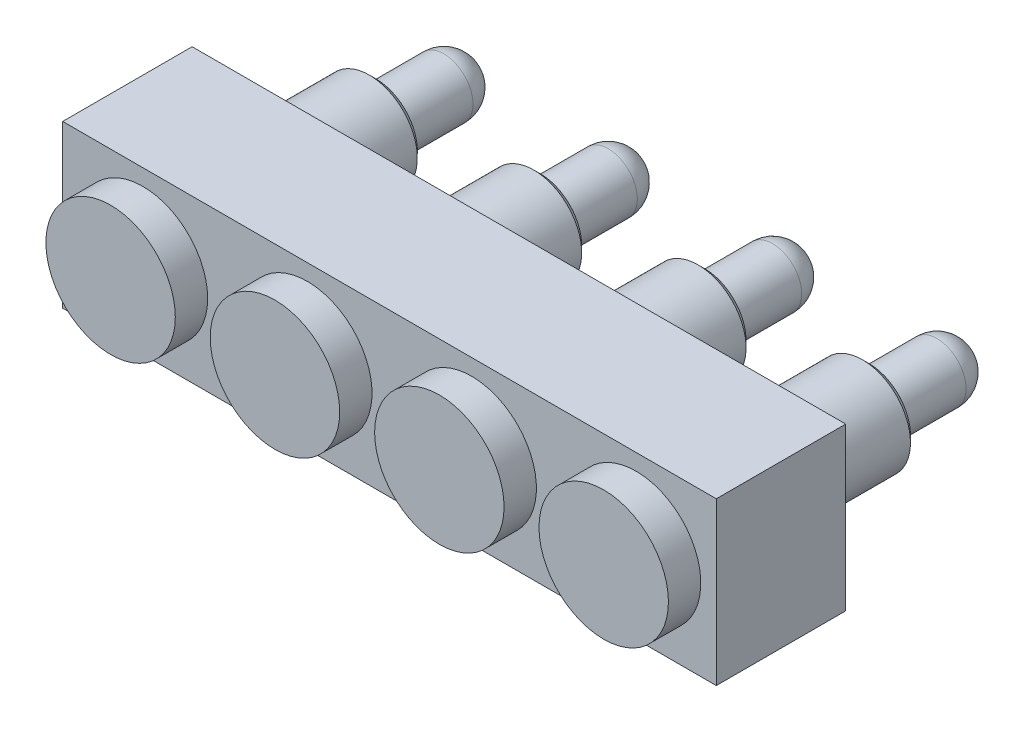
from build123d import *

# Parameters (mm, degrees)
SKETCH_1_W        = 10.1
SKETCH_1_H        = 2.5
SKETCH_1_R        = 0.74
EXTRUDE_1_DEPTH   = 2
SKETCH_2_R        = 1
EXTRUDE_2_DEPTH   = 0.5
SKETCH_3_R        = 0.74
EXTRUDE_3_DEPTH   = 1.6
EXTRUDE_3_2_DEPTH = 1.6
EXTRUDE_3_3_DEPTH = 1.6
EXTRUDE_3_4_DEPTH = 1.6
SKETCH_4_R        = 0.45
EXTRUDE_4_DEPTH   = 3.1
FILLET_1_R        = 0.45
FILLET_2_R        = 0.45
FILLET_3_R        = 0.45
FILLET_4_R        = 0.45
CHAMFER_1_SIZE    = 0.1
CHAMFER_2_SIZE    = 0.1
CHAMFER_3_SIZE    = 0.1
CHAMFER_4_SIZE    = 0.1


with BuildPart() as part:
    # 草图1 → 凸台-拉伸1 (new body)
    with BuildSketch(Plane.XY):
        with Locations((5.05405893, 1.252481567)):
            Rectangle(SKETCH_1_W, SKETCH_1_H)
        with Locations((3.78405893, 1.252481567)):
            Circle(SKETCH_1_R, mode=Mode.SUBTRACT)
        with Locations((1.24405893, 1.252481567)):
            Circle(SKETCH_1_R, mode=Mode.SUBTRACT)
        with Locations(Location((8.86405893, 1.252481567, 0), (0, 0, 180))):
            Circle(SKETCH_1_R, mode=Mode.SUBTRACT)
        with Locations(Location((6.32405893, 1.252481567, 0), (0, 0, 180))):
            Circle(SKETCH_1_R, mode=Mode.SUBTRACT)
    extrude(amount=EXTRUDE_1_DEPTH)

    # 草图2 → 凸台-拉伸2 (add)
    with BuildSketch(Plane.XY.offset(2)):
        with Locations((1.24405893, 1.252481567)):
            Circle(SKETCH_2_R)
        with Locations(Location((3.78405893, 1.252481567, 0), (0, 0, 180))):
            Circle(SKETCH_2_R)
        with Locations(Location((6.32405893, 1.252481567, 0), (0, 0, 180))):
            Circle(SKETCH_2_R)
        with Locations(Location((8.86405893, 1.252481567, 0), (0, 0, 180))):
            Circle(SKETCH_2_R)
    extrude(amount=EXTRUDE_2_DEPTH)


with BuildPart() as body_2:
    # 草图3 → 凸台-拉伸3 (new body)
    with BuildSketch(Plane(origin=(0, 0, 0), x_dir=(-1, 0, 0), z_dir=(0, 0, -1))):
        with Locations((-1.24405893, 1.252481567)):
            Circle(SKETCH_3_R)
    extrude(amount=EXTRUDE_3_DEPTH)



with BuildPart() as body_3:
    # 草图3 → Extrude 3 2 (new body)
    with BuildSketch(Plane(origin=(0, 0, 0), x_dir=(-1, 0, 0), z_dir=(0, 0, -1))):
        with Locations((-3.78405893, 1.252481567)):
            Circle(SKETCH_3_R)
    extrude(amount=EXTRUDE_3_2_DEPTH)


with BuildPart() as body_4:
    # 草图3 → Extrude 3 3 (new body)
    with BuildSketch(Plane(origin=(0, 0, 0), x_dir=(-1, 0, 0), z_dir=(0, 0, -1))):
        with Locations((-6.32405893, 1.252481567)):
            Circle(SKETCH_3_R)
    extrude(amount=EXTRUDE_3_3_DEPTH)


with BuildPart() as body_5:
    # 草图3 → Extrude 3 4 (new body)
    with BuildSketch(Plane(origin=(0, 0, 0), x_dir=(-1, 0, 0), z_dir=(0, 0, -1))):
        with Locations((-8.86405893, 1.252481567)):
            Circle(SKETCH_3_R)
    extrude(amount=EXTRUDE_3_4_DEPTH)


with BuildPart() as body_2_1:
    add(body_2.part)

    add(body_3.part)  # 凸台-拉伸4 merges body 3

    add(body_4.part)  # 凸台-拉伸4 merges body 4

    add(body_5.part)  # 凸台-拉伸4 merges body 5
    # 草图4 → 凸台-拉伸4 (add)
    with BuildSketch(Plane(origin=(0, 0, 0), x_dir=(-1, 0, 0), z_dir=(0, 0, -1))):
        with Locations((-8.86405893, 1.252481567)):
            Circle(SKETCH_4_R)
        with Locations((-6.32405893, 1.252481567)):
            Circle(SKETCH_4_R)
        with Locations((-3.78405893, 1.252481567)):
            Circle(SKETCH_4_R)
        with Locations((-1.24405893, 1.252481567)):
            Circle(SKETCH_4_R)
    extrude(amount=EXTRUDE_4_DEPTH)

    # 圆角1
    fillet_1_edges = [body_2_1.edges().sort_by_distance(p)[0] for p in [
        (9.31405893, 1.252481567, -3.1),
    ]]
    fillet(fillet_1_edges, radius=FILLET_1_R)

    # 圆角2
    fillet_2_edges = [body_2_1.edges().sort_by_distance(p)[0] for p in [
        (6.77405893, 1.252481567, -3.1),
    ]]
    fillet(fillet_2_edges, radius=FILLET_2_R)

    # 圆角3
    fillet_3_edges = [body_2_1.edges().sort_by_distance(p)[0] for p in [
        (4.23405893, 1.252481567, -3.1),
    ]]
    fillet(fillet_3_edges, radius=FILLET_3_R)

    # 圆角4
    fillet_4_edges = [body_2_1.edges().sort_by_distance(p)[0] for p in [
        (1.69405893, 1.252481567, -3.1),
    ]]
    fillet(fillet_4_edges, radius=FILLET_4_R)

    # 倒角1
    chamfer_1_edges = [body_2_1.edges().sort_by_distance(p)[0] for p in [
        (9.60405893, 1.252481567, -1.6),
    ]]
    chamfer(chamfer_1_edges, length=CHAMFER_1_SIZE)

    # 倒角2
    chamfer_2_edges = [body_2_1.edges().sort_by_distance(p)[0] for p in [
        (7.06405893, 1.252481567, -1.6),
    ]]
    chamfer(chamfer_2_edges, length=CHAMFER_2_SIZE)

    # 倒角3
    chamfer_3_edges = [body_2_1.edges().sort_by_distance(p)[0] for p in [
        (4.52405893, 1.252481567, -1.6),
    ]]
    chamfer(chamfer_3_edges, length=CHAMFER_3_SIZE)

    # 倒角4
    chamfer_4_edges = [body_2_1.edges().sort_by_distance(p)[0] for p in [
        (1.98405893, 1.252481567, -1.6),
    ]]
    chamfer(chamfer_4_edges, length=CHAMFER_4_SIZE)


solid = Compound([part.part, body_2_1.part])
